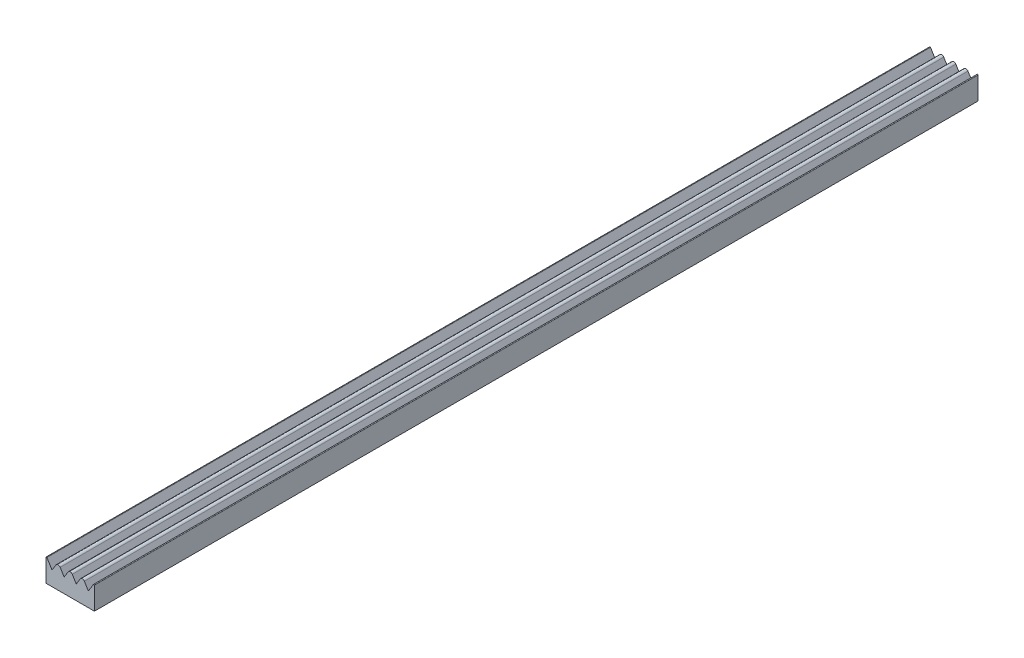
from build123d import *

# Parameters (mm, degrees)
BOSS_EXTRUDE1_DEPTH = 231.775


with BuildPart() as part:
    # Sketch1 → Boss-Extrude1 (new body)
    with BuildSketch(Plane.XY):
        with BuildLine():
            Line((0, 0), (-12.7, 0))
            Line((-12.7, 0), (-12.7, 5.907176879))
            ThreePointArc((-12.7, 5.907176879), (-12.608011679, 6.02925547), (-12.465304215, 5.974486745))
            Line((-12.465304215, 5.974486745), (-11.1125, 3.81))
            Line((-11.1125, 3.81), (-10.063478923, 5.488433723))
            ThreePointArc((-10.063478923, 5.488433723), (-9.525, 5.786884396), (-8.986521077, 5.488433723))
            Line((-8.986521077, 5.488433723), (-7.9375, 3.81))
            Line((-7.9375, 3.81), (-6.888478923, 5.488433723))
            ThreePointArc((-6.888478923, 5.488433723), (-6.35, 5.786884396), (-5.811521077, 5.488433723))
            Line((-5.811521077, 5.488433723), (-4.7625, 3.81))
            Line((-4.7625, 3.81), (-3.713478923, 5.488433723))
            ThreePointArc((-3.713478923, 5.488433723), (-3.175, 5.786884396), (-2.636521077, 5.488433723))
            Line((-2.636521077, 5.488433723), (-1.5875, 3.81))
            Line((-1.5875, 3.81), (-0.234695785, 5.974486745))
            ThreePointArc((-0.234695785, 5.974486745), (-0.091988321, 6.02925547), (0, 5.907176879))
            Line((0, 5.907176879), (0, 0))
        make_face()
    extrude(amount=BOSS_EXTRUDE1_DEPTH)


solid = part.part
